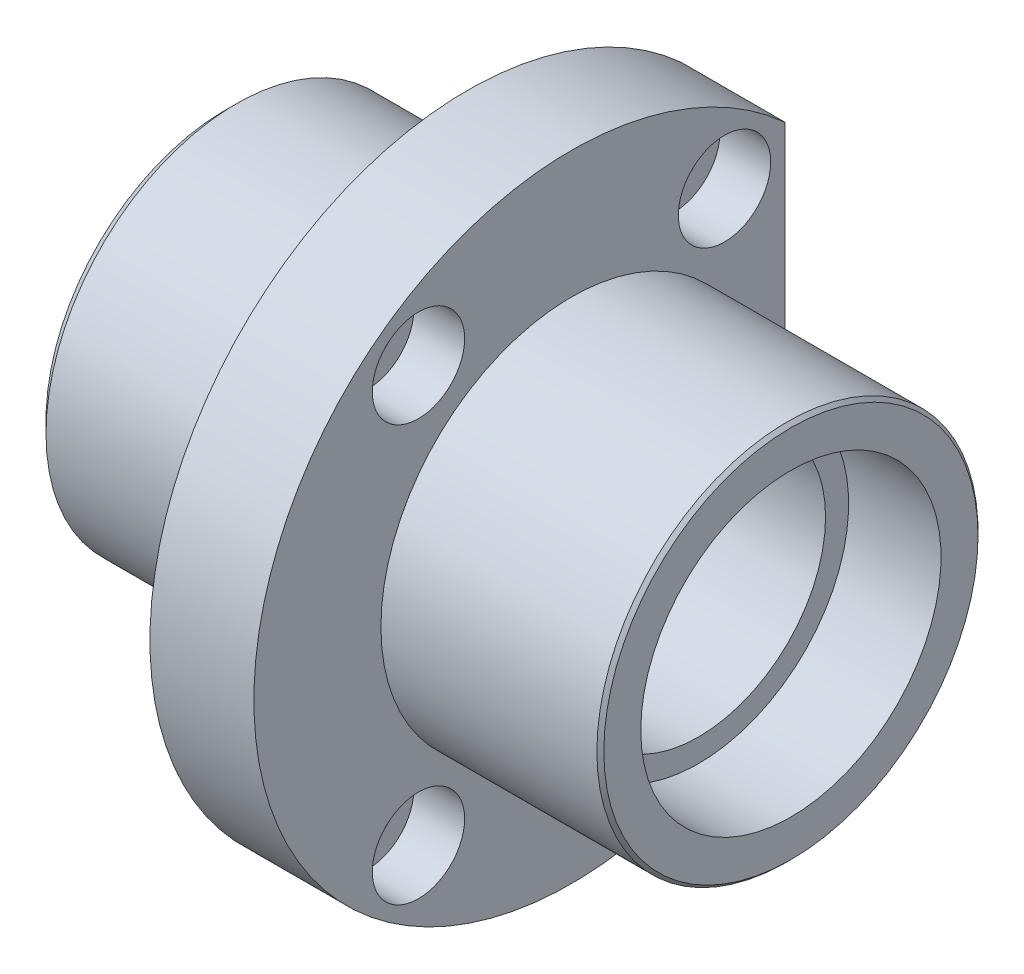
from build123d import *

# Parameters (mm, degrees)
CUT_EXTRUDE1_REACH                              = 51.117
CBORE_FOR_M4_SOCKET_HEAD_CAP_SCREW1_D           = 4.5
CBORE_FOR_M4_SOCKET_HEAD_CAP_SCREW1_CBORE_D     = 8
CBORE_FOR_M4_SOCKET_HEAD_CAP_SCREW1_CBORE_DEPTH = 4.4
CHAMFER1_SIZE                                   = 1
CHAMFER2_SIZE                                   = 0.3


with BuildPart() as part:
    # Sketch1 → Revolve1 (revolve)
    with BuildSketch(Plane.XY, mode=Mode.PRIVATE) as revolve1_sk:
        Polygon((-21, 0), (-21, 16.5), (0, 16.5), (0, 27.5), (9, 27.5), (9, 16.5), (28, 16.5), (28, 0), align=None)
    revolve(revolve1_sk.sketch.rotate(Axis((-30.202765387, 0, 0), (1, 0, 0)), 90), axis=Axis((-30.202765387, 0, 0), (1, 0, 0)))

    # Sketch2 → Cut-Revolve1 (revolve, cut)
    with BuildSketch(Plane.XY, mode=Mode.PRIVATE) as cut_revolve1_sk:
        Polygon((-21, 0), (-21, 13), (-5, 13), (-5, 11), (20, 11), (20, 13), (28, 13), (28, 0), align=None)
    revolve(cut_revolve1_sk.sketch.rotate(Axis((-25.491403617, 0, 0), (1, 0, 0)), 90), axis=Axis((-25.491403617, 0, 0), (1, 0, 0)), mode=Mode.SUBTRACT)

    # Sketch5 → Cut-Extrude1 (cut, up to next)
    with BuildSketch(Plane(origin=(9, 0, 0), x_dir=(0, 0, -1), z_dir=(1, 0, 0)), mode=Mode.PRIVATE) as cut_extrude1_sk1:
        with BuildLine():
            Line((18.5, 20.346989949), (18.5, -20.346989949))
            ThreePointArc((18.5, -20.346989949), (27.5, 0), (18.5, 20.346989949))
        make_face()
    cut_extrude1_tool1 = extrude(cut_extrude1_sk1.sketch, amount=-CUT_EXTRUDE1_REACH, mode=Mode.PRIVATE) & part.part
    add(cut_extrude1_tool1.solids().sort_by_distance((9, 0, -22.155812))[0], mode=Mode.SUBTRACT)

    # CBORE for M4 Socket Head Cap Screw1 (through all)
    with Locations(Plane(origin=(9, 0, 0), x_dir=(0, 0, -1), z_dir=(1, 0, 0))):
        with Locations((-13.25, 18), (13.25, 18), (13.25, -18), (-13.25, -18)):
            CounterBoreHole(CBORE_FOR_M4_SOCKET_HEAD_CAP_SCREW1_D / 2, CBORE_FOR_M4_SOCKET_HEAD_CAP_SCREW1_CBORE_D / 2, CBORE_FOR_M4_SOCKET_HEAD_CAP_SCREW1_CBORE_DEPTH)

    # Chamfer1
    chamfer1_edges = [part.edges().sort_by_distance(p)[0] for p in [
        (-21, 0, -16.5),
    ]]
    chamfer(chamfer1_edges, length=CHAMFER1_SIZE)

    # Chamfer2
    chamfer2_edges = [part.edges().sort_by_distance(p)[0] for p in [
        (28, 0, -16.5),
    ]]
    chamfer(chamfer2_edges, length=CHAMFER2_SIZE)


solid = part.part
